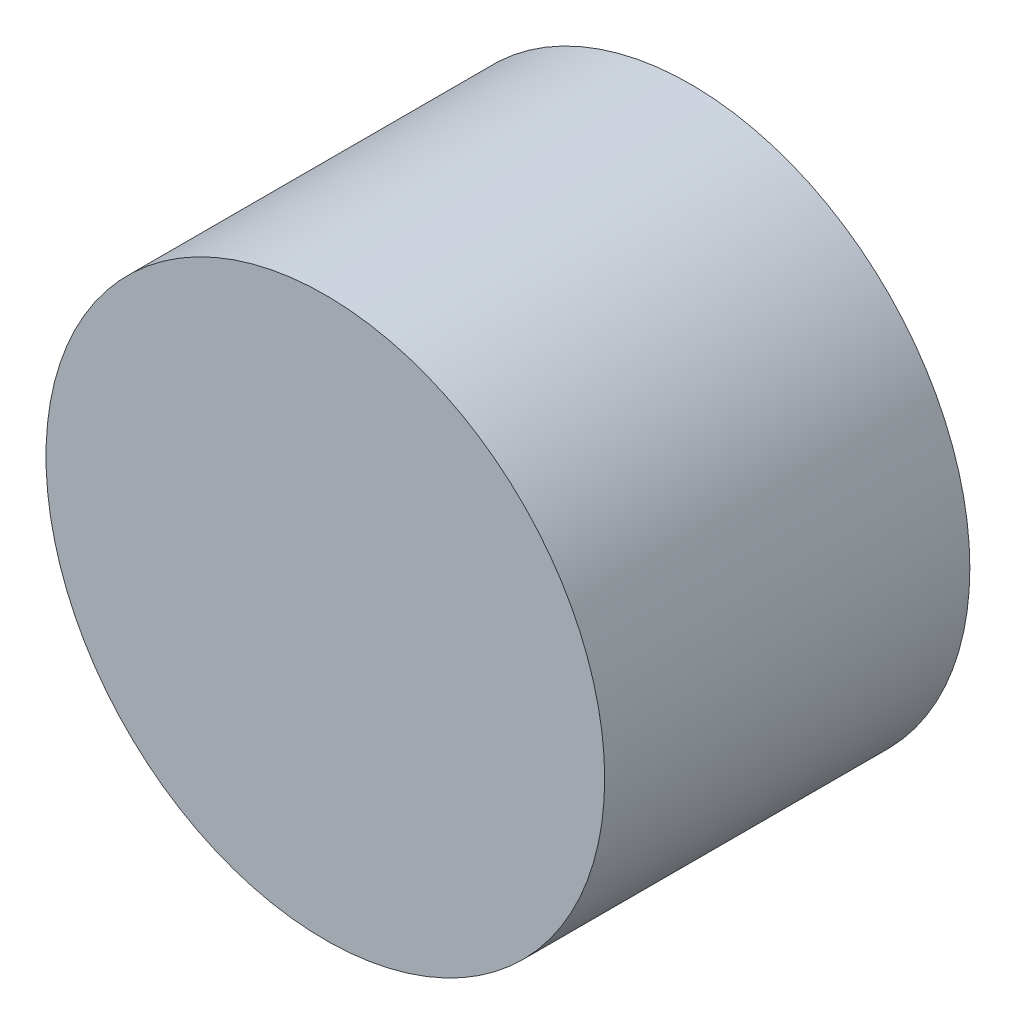
from build123d import *

# Parameters (mm, degrees)
SKETCH_1_R        = 35
EXTRUDE_203_DEPTH = 45.75


with BuildPart() as part:
    # 草图1 → Extrude 203 (new body)
    with BuildSketch(Plane.XY):
        Circle(SKETCH_1_R)
    extrude(amount=EXTRUDE_203_DEPTH)


solid = part.part
